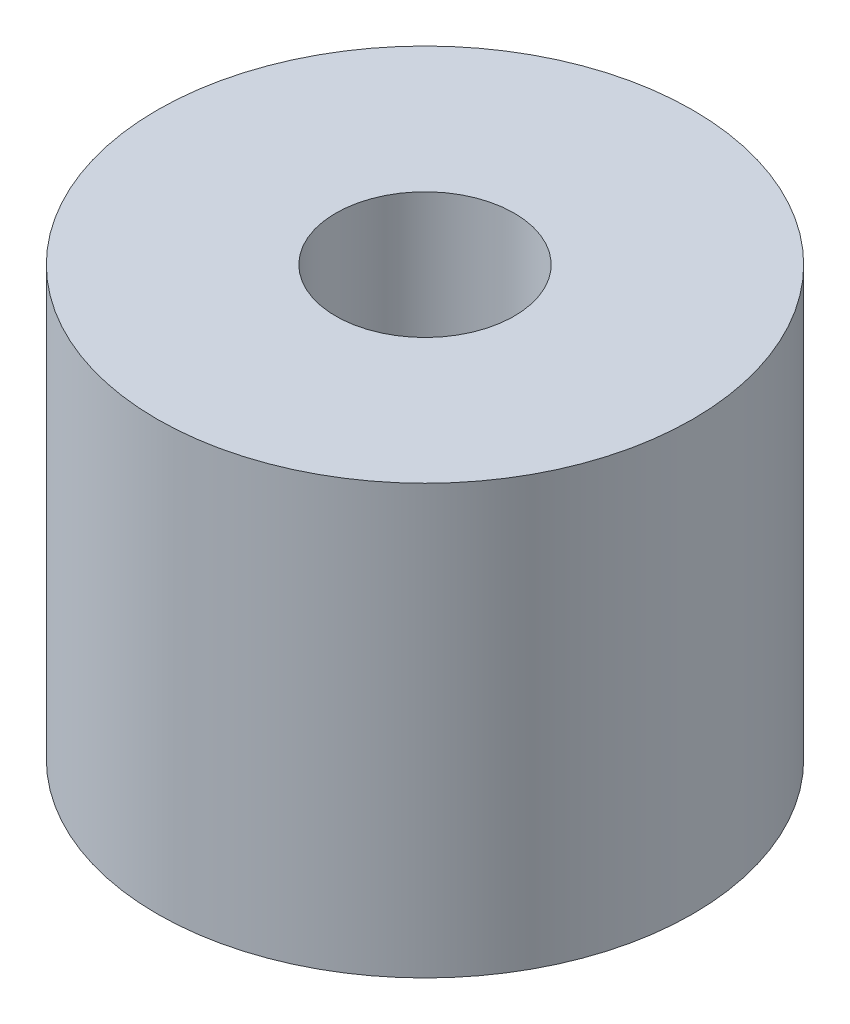
from build123d import *

# Parameters (mm, degrees)
SKETCH1_R           = 4.7625
SKETCH1_R_2         = 1.5875
BOSS_EXTRUDE1_DEPTH = 7.62


with BuildPart() as part:
    # Sketch1 → Boss-Extrude1 (new body)
    with BuildSketch(Plane(origin=(0, 0, 0), x_dir=(1, 0, 0), z_dir=(0, 1, 0))):
        with Locations(Location((0, 0, 0), (0, 0, 90))):
            Circle(SKETCH1_R)
        with Locations(Location((0, 0, 0), (0, 0, 90))):
            Circle(SKETCH1_R_2, mode=Mode.SUBTRACT)
    extrude(amount=BOSS_EXTRUDE1_DEPTH)


solid = part.part
